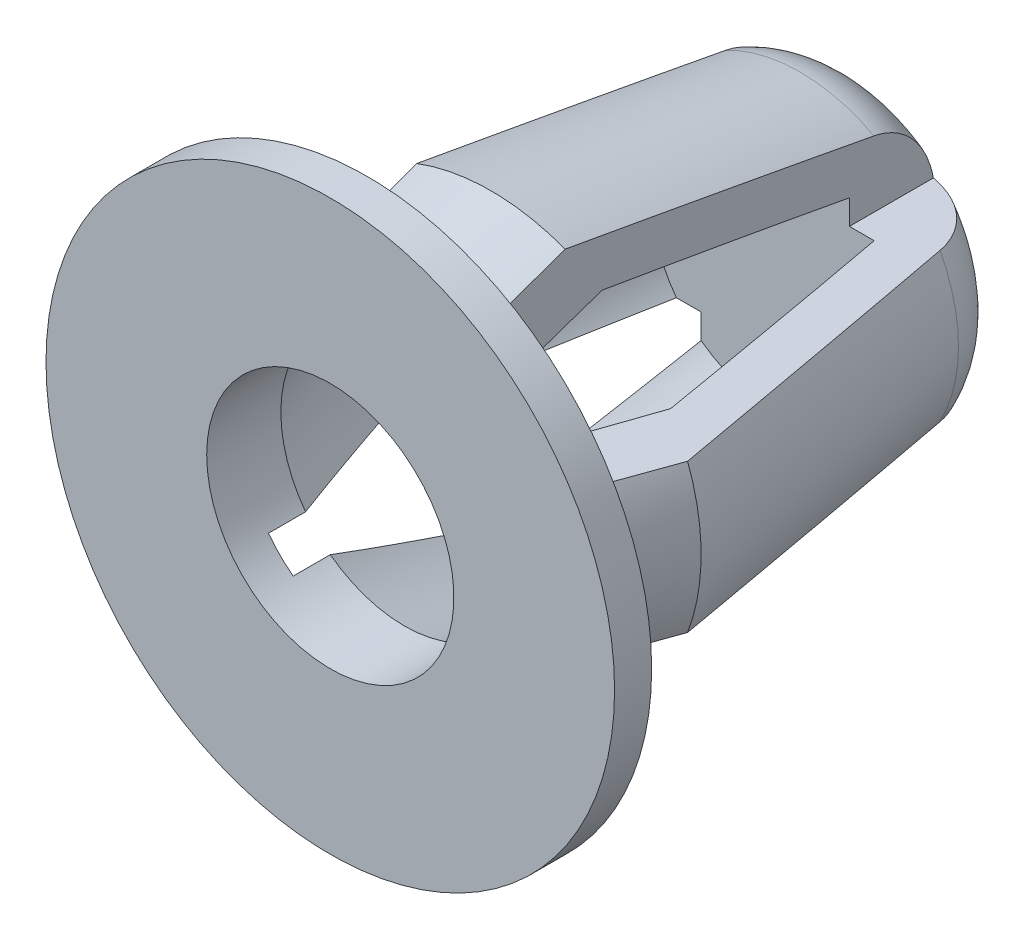
from build123d import *

# Parameters (mm, degrees)
FILLET_1_R               = 3
CUT_EXTRUDE_1_REACH      = 28.958
SKETCH_2_W               = 10.643557705
SKETCH_2_H               = 9.097593034
PATTERN_CIRCULAR_1_COUNT = 4


with BuildPart() as part:
    # ｽｹｯﾁ1 → 回転1 (revolve)
    with BuildSketch(Plane(origin=(0, 0, 0), x_dir=(0, 0, -1), z_dir=(1, 0, 0)), mode=Mode.PRIVATE) as revolve_1_sk:
        Polygon((0, 7.5), (2, 7.5), (5, 8.5), (20, 6), (20, 0), (16.5, 0), (16.5, 5), (6.5, 6.5), (1.5, 5), (-1.5, 5), (-1.5, 11.5), (0, 11.5), align=None)
    revolve(revolve_1_sk.sketch.rotate(Axis((0, 0, 0), (0, 0, 1)), 90), axis=Axis((0, 0, 0), (0, 0, 1)))

    # ﾌｨﾚｯﾄ1
    fillet_1_edges = [part.edges().sort_by_distance(p)[0] for p in [
        (6, 0, -20),
    ]]
    fillet(fillet_1_edges, radius=FILLET_1_R)

    # ｶｯﾄ - 押し出し1: up to this face of the body (flat: up to its plane)
    cut_extrude_1_end = Plane(part.part.faces().sort_by_distance((11.174730881, 0, 0))[0])
    # ｽｹｯﾁ2 → ｶｯﾄ - 押し出し1 (cut, up to the picked face)
    with BuildSketch(Plane(origin=(0, 0, -20), x_dir=(-1, 0, 0), z_dir=(0, 0, -1)), mode=Mode.PRIVATE) as cut_extrude_1_sk1:
        with Locations((8.321778852, 7.548796517)):
            Rectangle(SKETCH_2_W, SKETCH_2_H)
    cut_extrude_1_tool1 = split(extrude(cut_extrude_1_sk1.sketch, amount=-CUT_EXTRUDE_1_REACH, mode=Mode.PRIVATE), bisect_by=cut_extrude_1_end, keep=Keep.BOTH, mode=Mode.PRIVATE)
    cut_extrude_1 = cut_extrude_1_tool1.solids().sort_by(Axis((-8.321779, 7.548797, -20), (0, 0, 1)))[0]
    add(cut_extrude_1, mode=Mode.SUBTRACT)

    # 円形ﾊﾟﾀｰﾝ1: ｶｯﾄ - 押し出し1 ×4 about axis
    pattern_circular_1_axis = Axis((0, 0, 0), (0, 0, 1))
    for i in range(1, PATTERN_CIRCULAR_1_COUNT):
        add(cut_extrude_1.rotate(pattern_circular_1_axis, i * 360 / PATTERN_CIRCULAR_1_COUNT), mode=Mode.SUBTRACT)


solid = part.part
